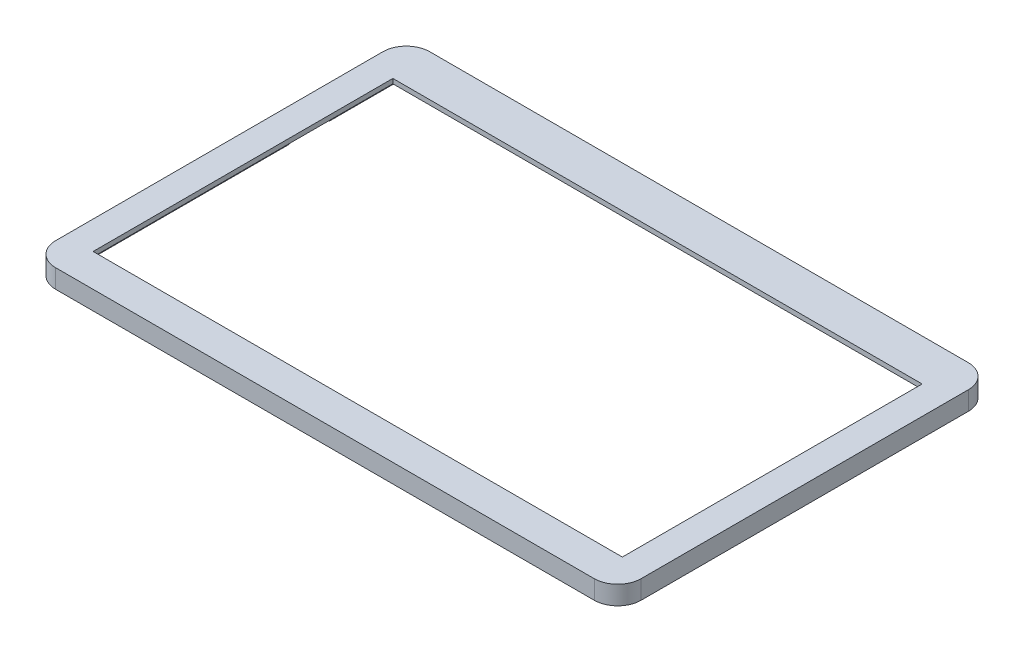
from build123d import *

# Parameters (mm, degrees)
SKETCH_1_W          = 250
SKETCH_1_H          = 156
SKETCH_1_W_2        = 226
SKETCH_1_H_2        = 128
EXTRUDE_1_DEPTH     = 8
SKETCH_2_W          = 235.5
SKETCH_2_H          = 139.5
CUT_EXTRUDE_3_DEPTH = 6
SKETCH_11_W         = 250
SKETCH_11_H         = 8
EXTRUDE_3_DEPTH     = 3.75
CUT_EXTRUDE_4_DEPTH = 10
SKETCH_13_R         = 2
CUT_EXTRUDE_5_DEPTH = 6
SKETCH_14_W         = 6.25
SKETCH_14_H         = 17.2
CUT_EXTRUDE_6_DEPTH = 1.5
SKETCH_16_W         = 3.85
SKETCH_16_H         = 17.2
CUT_EXTRUDE_8_DEPTH = 1.5


with BuildPart() as part:
    # 草图1 → 凸台-拉伸1 (new body)
    with BuildSketch(Plane(origin=(0, 0, 0), x_dir=(1, 0, 0), z_dir=(0, 1, 0))):
        with Locations((25.659327926, -14.898030127)):
            Rectangle(SKETCH_1_W, SKETCH_1_H)
        with Locations((25.659327926, -14.898030127)):
            Rectangle(SKETCH_1_W_2, SKETCH_1_H_2, mode=Mode.SUBTRACT)
    extrude(amount=EXTRUDE_1_DEPTH)

    # 草图2 → 切除-拉伸3 (cut)
    with BuildSketch(Plane.XZ):
        with Locations((24.659327926, 12.898030127)):
            Rectangle(SKETCH_2_W, SKETCH_2_H)
    extrude(amount=-CUT_EXTRUDE_3_DEPTH, mode=Mode.SUBTRACT)

    # 草图11 → 凸台-拉伸3 (add)
    with BuildSketch(Plane(origin=(0, 0, -63.101969873), x_dir=(-1, 0, 0), z_dir=(0, 0, -1))):
        with Locations((-25.659327926, 4)):
            Rectangle(SKETCH_11_W, SKETCH_11_H)
    extrude(amount=EXTRUDE_3_DEPTH)

    # 草图12 → 切除-拉伸4 (cut)
    with BuildSketch(Plane.XZ):
        with BuildLine():
            Line((-89.340672074, 92.898030127), (-99.340672074, 92.898030127))
            Line((-99.340672074, 92.898030127), (-99.340672074, 82.898030127))
            ThreePointArc((-99.340672074, 82.898030127), (-96.411739886, 89.969097939), (-89.340672074, 92.898030127))
        make_face()
        with BuildLine():
            Line((-99.340672074, -56.851969873), (-99.340672074, -66.851969873))
            Line((-99.340672074, -66.851969873), (-89.340672074, -66.851969873))
            ThreePointArc((-89.340672074, -66.851969873), (-96.411739886, -63.923037684), (-99.340672074, -56.851969873))
        make_face()
        with BuildLine():
            Line((140.659327926, -66.851969873), (150.659327926, -66.851969873))
            Line((150.659327926, -66.851969873), (150.659327926, -56.851969873))
            ThreePointArc((150.659327926, -56.851969873), (147.730395738, -63.923037684), (140.659327926, -66.851969873))
        make_face()
        with BuildLine():
            Line((150.659327926, 82.898030127), (150.659327926, 92.898030127))
            Line((150.659327926, 92.898030127), (140.659327926, 92.898030127))
            ThreePointArc((140.659327926, 92.898030127), (147.730395738, 89.969097939), (150.659327926, 82.898030127))
        make_face()
    extrude(amount=-CUT_EXTRUDE_4_DEPTH, mode=Mode.SUBTRACT)

    # 草图13 → 切除-拉伸5 (cut)
    with BuildSketch(Plane.XZ):
        with Locations(Location((-86.340672074, 87.898030127, 0), (0, 0, 270))):
            Circle(SKETCH_13_R)
        with Locations(Location((137.659327926, 87.898030127, 0), (0, 0, 270))):
            Circle(SKETCH_13_R)
        with Locations(Location((137.659327926, -61.851969873, 0), (0, 0, 270))):
            Circle(SKETCH_13_R)
        with Locations(Location((-86.340672074, -61.851969873, 0), (0, 0, 270))):
            Circle(SKETCH_13_R)
    extrude(amount=-CUT_EXTRUDE_5_DEPTH, mode=Mode.SUBTRACT)

    # 草图14 → 切除-拉伸6 (cut)
    with BuildSketch(Plane.XZ):
        with Locations((-96.215672074, -19.101969873)):
            Rectangle(SKETCH_14_W, SKETCH_14_H)
    extrude(amount=-CUT_EXTRUDE_6_DEPTH, mode=Mode.SUBTRACT)

    # 草图16 → 切除-拉伸8 (cut)
    with BuildSketch(Plane.XZ.offset(-1.5)):
        with Locations((-95.015672074, -19.101969873)):
            Rectangle(SKETCH_16_W, SKETCH_16_H)
    extrude(amount=-CUT_EXTRUDE_8_DEPTH, mode=Mode.SUBTRACT)


solid = part.part
